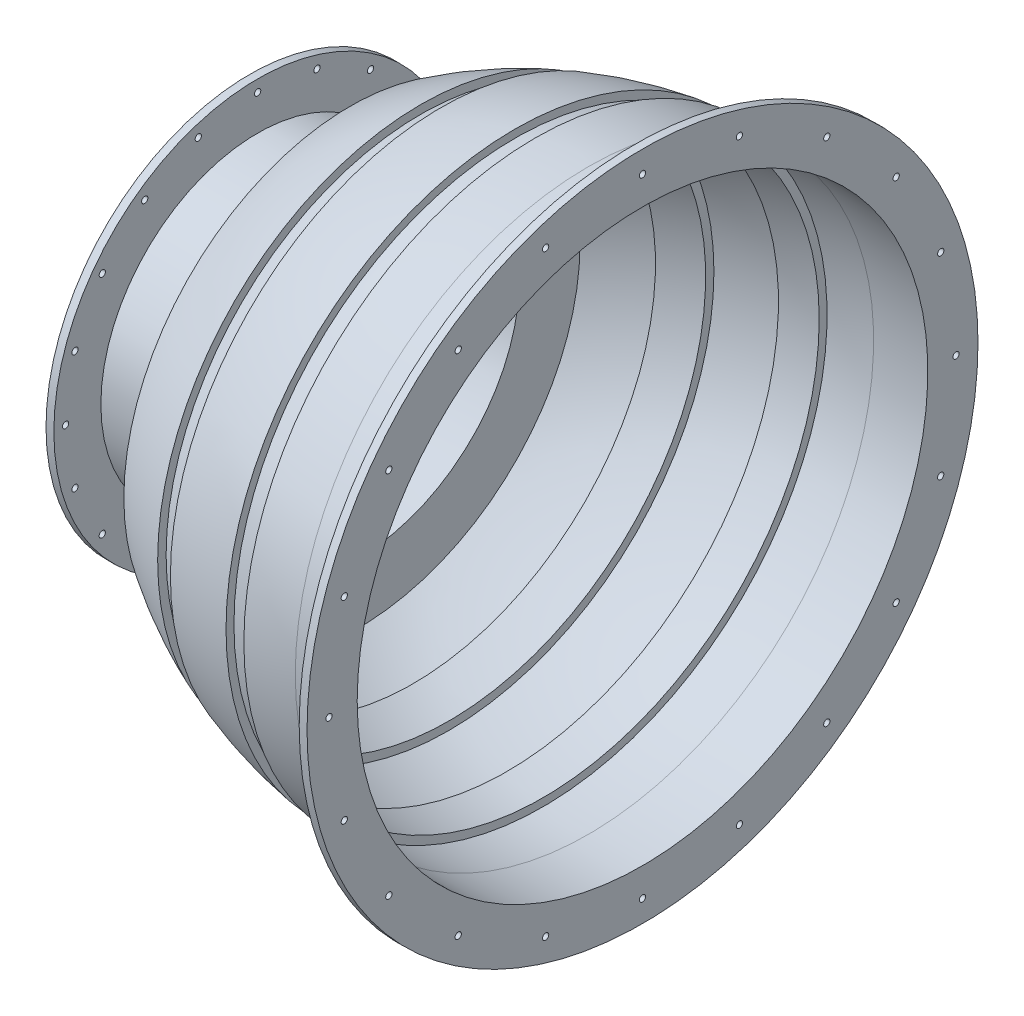
from build123d import *

# Parameters (mm, degrees)
SKETCH2_R          = 2
CUT_EXTRUDE1_DEPTH = 10
SKETCH3_R          = 2
CUT_EXTRUDE2_DEPTH = 10
CIRPATTERN1_COUNT  = 20


with BuildPart() as part:
    # Sketch1 → Revolve1 (revolve)
    with BuildSketch(Plane.XY, mode=Mode.PRIVATE) as revolve1_sk:
        with BuildLine():
            Line((125.35, 214), (125.35, 182))
            Line((125.35, 182), (90.777397171, 182))
            ThreePointArc((90.777397171, 182), (76.303023046, 182.019382519), (61.85, 181.233248409))
            Line((61.85, 181.233248409), (61.85, 176.215984101))
            ThreePointArc((61.85, 176.215984101), (50.315984949, 174.982485494), (38.85, 173.225723944))
            Line((38.85, 173.225723944), (38.85, 178.301556459))
            ThreePointArc((38.85, 178.301556459), (20.180307559, 174.359561219), (1.85, 169.058941719))
            Line((1.85, 169.058941719), (1.85, 163.789069776))
            ThreePointArc((1.85, 163.789069776), (-9.759071612, 159.566063637), (-21.15, 154.785783832))
            Line((-21.15, 154.785783832), (-21.15, 160.254972016))
            ThreePointArc((-21.15, 160.254972016), (-39.005794183, 151.605014565), (-56.15, 141.618656033))
            Line((-56.15, 141.618656033), (-56.15, 103))
            Line((-56.15, 103), (-85.15, 95))
            Line((-85.15, 95), (-125.15, 95))
            Line((-125.15, 95), (-125.15, 130))
            Line((-125.15, 130), (-120.15, 130))
            Line((-120.15, 130), (-120.15, 100))
            Line((-120.15, 100), (-85.827011196, 100))
            Line((-85.827011196, 100), (-61.15, 106.807451364))
            Line((-61.15, 106.807451364), (-61.15, 144.350032201))
            ThreePointArc((-61.15, 144.350032201), (-39.212159428, 157.147213449), (-16.15, 167.785516856))
            Line((-16.15, 167.785516856), (-16.15, 162.383703009))
            ThreePointArc((-16.15, 162.383703009), (-9.683274673, 164.95660686), (-3.15, 167.355500925))
            Line((-3.15, 167.355500925), (-3.15, 172.650142104))
            ThreePointArc((-3.15, 172.650142104), (20.086400181, 179.487164129), (43.85, 184.174006054))
            Line((43.85, 184.174006054), (43.85, 179.116880269))
            ThreePointArc((43.85, 179.116880269), (50.339565328, 180.026751253), (56.85, 180.772783246))
            Line((56.85, 180.772783246), (56.85, 185.798153237))
            ThreePointArc((56.85, 185.798153237), (73.830693152, 186.94526342), (90.85, 187))
            Line((90.85, 187), (120.35, 187))
            Line((120.35, 187), (120.35, 214))
            Line((120.35, 214), (125.35, 214))
        make_face()
    revolve(revolve1_sk.sketch.rotate(Axis((-99.349120664, 0, 0), (1, 0, 0)), 90), axis=Axis((-99.349120664, 0, 0), (1, 0, 0)))

    # Sketch2 → Cut-Extrude1 (cut)
    with BuildSketch(Plane.ZY.offset(125.15)):
        with Locations((0, 122.5)):
            Circle(SKETCH2_R)
    cut_extrude1 = extrude(amount=-CUT_EXTRUDE1_DEPTH, mode=Mode.SUBTRACT)

    # Sketch3 → Cut-Extrude2 (cut)
    with BuildSketch(Plane(origin=(125.35, 0, 0), x_dir=(0, 0, -1), z_dir=(1, 0, 0))):
        with Locations((0, 200)):
            Circle(SKETCH3_R)
    cut_extrude2 = extrude(amount=-CUT_EXTRUDE2_DEPTH, mode=Mode.SUBTRACT)

    # CirPattern1: Cut-Extrude1, Cut-Extrude2 ×20 about axis
    cirpattern1_axis = Axis((0, 0, 0), (1, 0, 0))
    add([cut_extrude1.rotate(cirpattern1_axis, i * 360 / CIRPATTERN1_COUNT) for i in range(1, CIRPATTERN1_COUNT)], mode=Mode.SUBTRACT)
    add([cut_extrude2.rotate(cirpattern1_axis, i * 360 / CIRPATTERN1_COUNT) for i in range(1, CIRPATTERN1_COUNT)], mode=Mode.SUBTRACT)


solid = part.part
